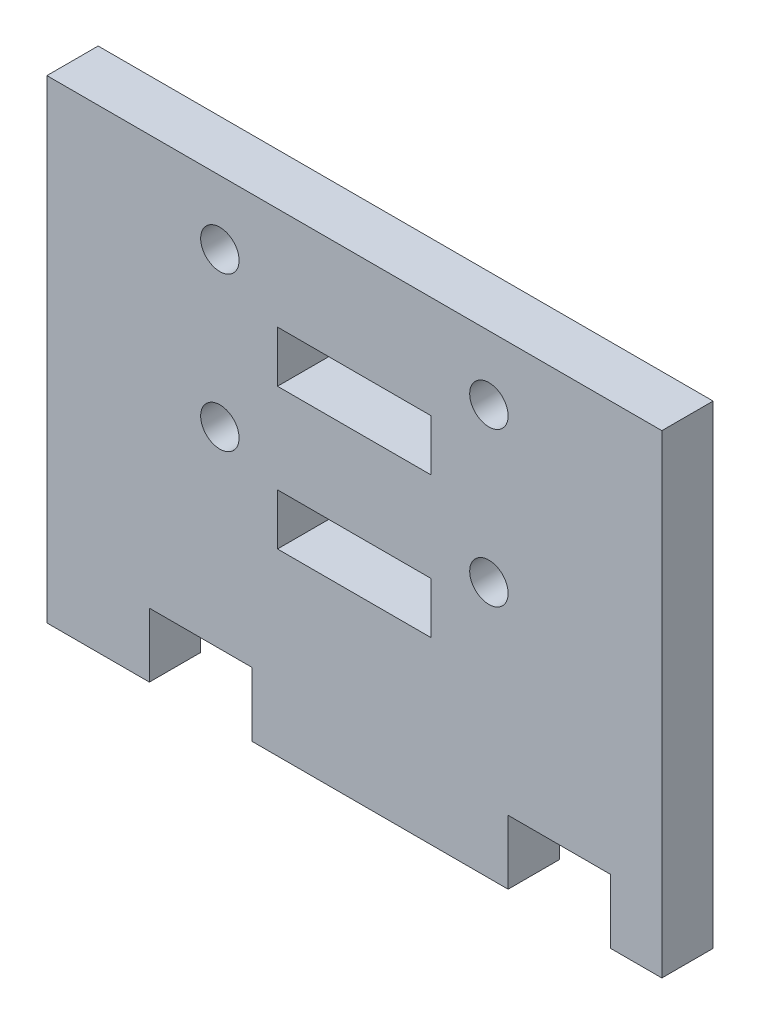
from build123d import *

# Parameters (mm, degrees)
SKETCH1_R           = 0.75
SKETCH1_W           = 6
SKETCH1_H           = 2
BOSS_EXTRUDE1_DEPTH = 2


with BuildPart() as part:
    # Sketch1 → Boss-Extrude1 (new body)
    with BuildSketch(Plane.XY):
        Polygon((4, 2.5), (8, 2.5), (8, 0), (18, 0), (18, 2.5), (22, 2.5), (22, 0), (24, 0), (24, 18.5), (0, 18.5), (0, 0), (4, 0), align=None)
        with Locations((6.75, 16)):
            Circle(SKETCH1_R, mode=Mode.SUBTRACT)
        with Locations((17.25, 10)):
            Circle(SKETCH1_R, mode=Mode.SUBTRACT)
        with Locations((17.25, 16)):
            Circle(SKETCH1_R, mode=Mode.SUBTRACT)
        with Locations((6.75, 10)):
            Circle(SKETCH1_R, mode=Mode.SUBTRACT)
        with Locations((12, 13.5)):
            Rectangle(SKETCH1_W, SKETCH1_H, mode=Mode.SUBTRACT)
        with Locations((12, 8)):
            Rectangle(SKETCH1_W, SKETCH1_H, mode=Mode.SUBTRACT)
    extrude(amount=BOSS_EXTRUDE1_DEPTH)


solid = part.part
